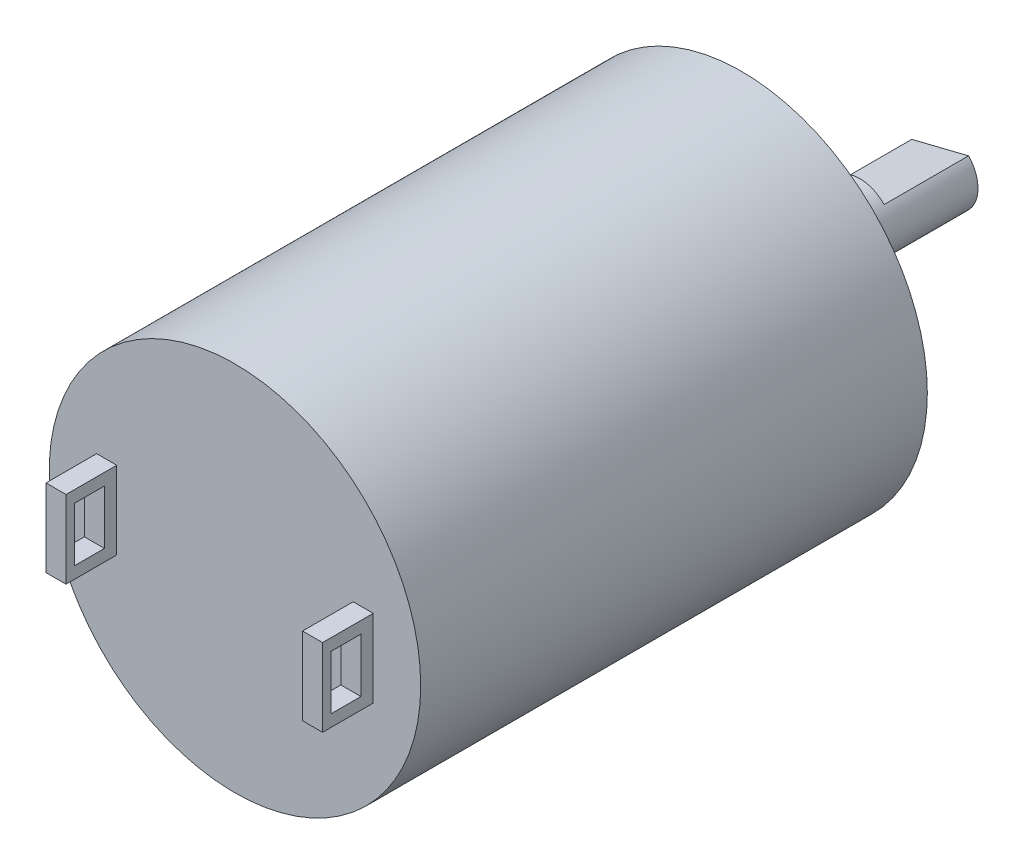
from build123d import *

# Parameters (mm, degrees)
SKETCH1_R           = 11
BOSS_EXTRUDE1_DEPTH = 30
SKETCH2_R           = 3
BOSS_EXTRUDE2_DEPTH = 2
SKETCH3_R           = 2
BOSS_EXTRUDE3_DEPTH = 10
SKETCH4_W           = 1.187251635
SKETCH4_H           = 4.601713706
BOSS_EXTRUDE4_DEPTH = 3
SKETCH5_W           = 1.771317087
SKETCH5_H           = 3.201713706
CUT_EXTRUDE1_DEPTH  = 40.726440378
CUT_EXTRUDE2_DEPTH  = 5


with BuildPart() as part:
    # Sketch1 → Boss-Extrude1 (new body)
    with BuildSketch(Plane.XY):
        Circle(SKETCH1_R)
    extrude(amount=BOSS_EXTRUDE1_DEPTH)

    # Sketch2 → Boss-Extrude2 (add)
    with BuildSketch(Plane(origin=(0, 0, 0), x_dir=(-1, 0, 0), z_dir=(0, 0, -1))):
        Circle(SKETCH2_R)
    extrude(amount=BOSS_EXTRUDE2_DEPTH)

    # Sketch3 → Boss-Extrude3 (add)
    with BuildSketch(Plane(origin=(0, 0, -2), x_dir=(-1, 0, 0), z_dir=(0, 0, -1))):
        Circle(SKETCH3_R)
    extrude(amount=BOSS_EXTRUDE3_DEPTH)

    # Sketch4 → Boss-Extrude4 (add)
    with BuildSketch(Plane.XY.offset(30)):
        with Locations((-7.594653551, 0)):
            Rectangle(SKETCH4_W, SKETCH4_H)
        with Locations((7.594653551, 0)):
            Rectangle(SKETCH4_W, SKETCH4_H)
    extrude(amount=BOSS_EXTRUDE4_DEPTH)

    # Sketch5 → Cut-Extrude1 (cut, through all)
    with BuildSketch(Plane.ZY.offset(8.188279368)):
        with Locations((31.614341457, 0)):
            Rectangle(SKETCH5_W, SKETCH5_H)
    extrude(amount=-CUT_EXTRUDE1_DEPTH, mode=Mode.SUBTRACT)

    # Sketch6 → Cut-Extrude2 (cut)
    with BuildSketch(Plane(origin=(0, 0, -12), x_dir=(-1, 0, 0), z_dir=(0, 0, -1))):
        Polygon((-45.221186331, 12.264551338), (-1.439858088, 1.388095345), (1.922054875, 0.55290601), (45.703383118, -10.323549984), (67.456295106, 77.239106502), (-23.468274343, 99.827207824), align=None)
    extrude(amount=-CUT_EXTRUDE2_DEPTH, mode=Mode.SUBTRACT)


solid = part.part
